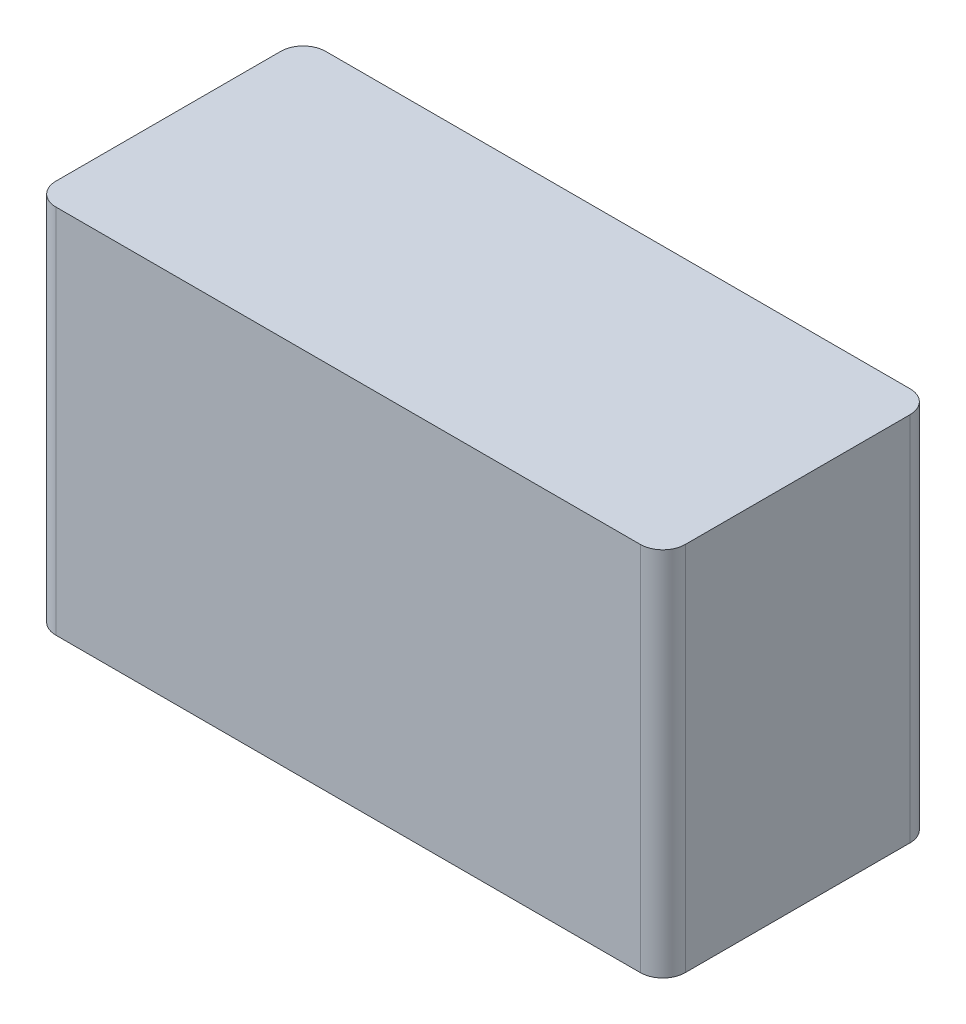
from build123d import *

# Parameters (mm, degrees)
SKETCH2_W           = 88.9
SKETCH2_H           = 38.1
BOSS_EXTRUDE1_DEPTH = 52.3875
FILLET1_R           = 3.175


with BuildPart() as part:
    # Sketch2 → Boss-Extrude1 (new body)
    with BuildSketch(Plane(origin=(0, 0, 0), x_dir=(1, 0, 0), z_dir=(0, 1, 0))):
        with Locations((44.45, 19.05)):
            Rectangle(SKETCH2_W, SKETCH2_H)
    extrude(amount=BOSS_EXTRUDE1_DEPTH)

    # Fillet1
    fillet1_edges = [part.edges().sort_by_distance(p)[0] for p in [
        (0, 26.19375, -38.1),
        (88.9, 26.19375, -38.1),
        (88.9, 26.19375, 0),
        (0, 26.19375, 0),
    ]]
    fillet(fillet1_edges, radius=FILLET1_R)


solid = part.part
